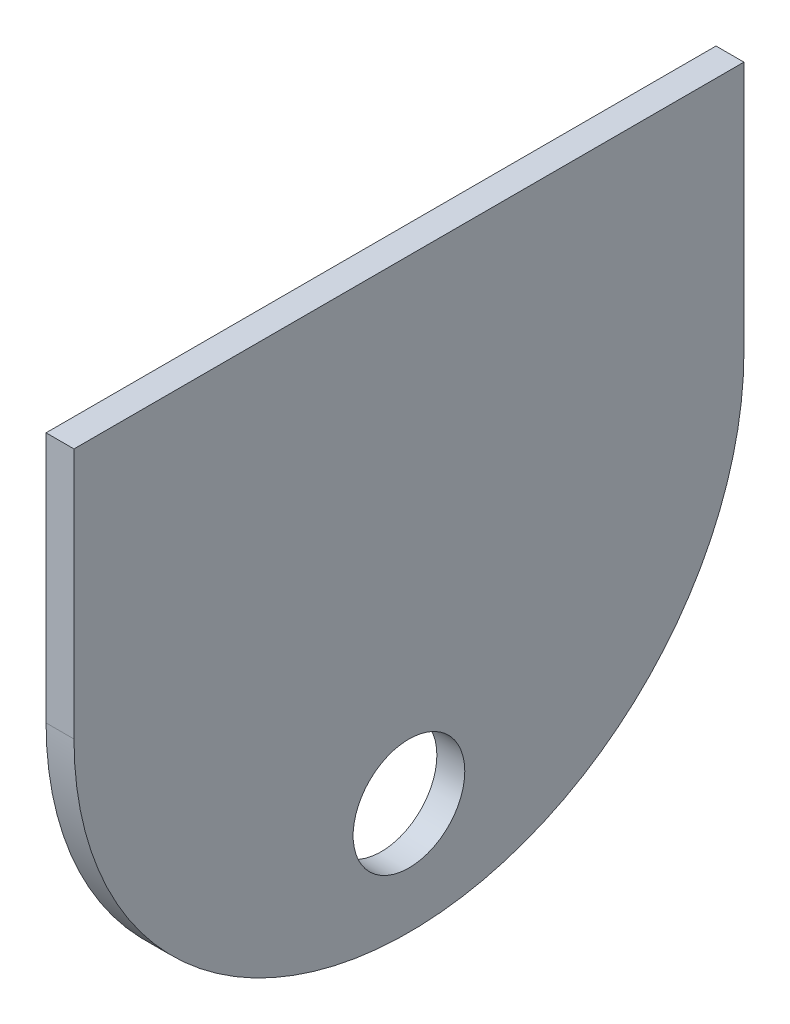
from build123d import *

# Parameters (mm, degrees)
BOSS_EXTRUDE1_DEPTH = 3.175
SKETCH2_R           = 6.35
CUT_EXTRUDE1_DEPTH  = 54.975


with BuildPart() as part:
    # Sketch1 → Boss-Extrude1 (new body)
    with BuildSketch(Plane(origin=(0, 0, 0), x_dir=(0, 0, -1), z_dir=(1, 0, 0))):
        with BuildLine():
            Line((-38.1, 0), (-38.1, 28.575))
            Line((-38.1, 28.575), (38.1, 28.575))
            Line((38.1, 28.575), (38.1, 0))
            ThreePointArc((38.1, 0), (0, -38.1), (-38.1, 0))
        make_face()
    extrude(amount=BOSS_EXTRUDE1_DEPTH)

    # Sketch2 → Cut-Extrude1 (cut, through all)
    with BuildSketch(Plane(origin=(3.175, 0, 0), x_dir=(0, 0, -1), z_dir=(1, 0, 0))):
        with Locations((0, -25.4)):
            Circle(SKETCH2_R)
    extrude(amount=-CUT_EXTRUDE1_DEPTH, mode=Mode.SUBTRACT)


solid = part.part
